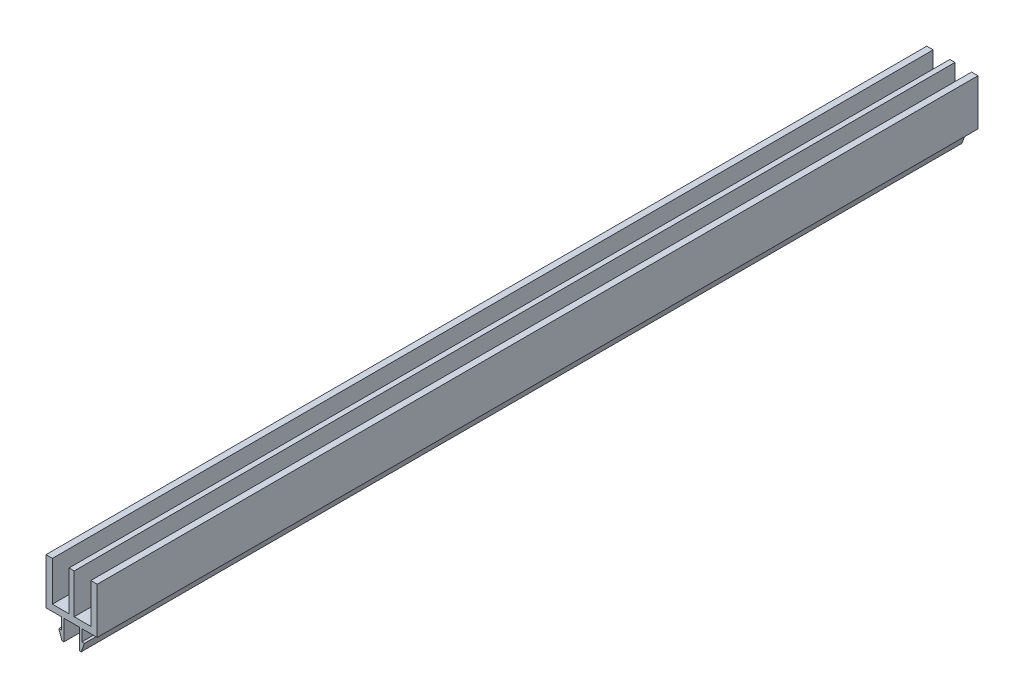
from build123d import *

# Parameters (mm, degrees)
BOSS_EXTRU_1_DEPTH = 344


with BuildPart() as part:
    # Esquisse1 → Boss.-Extru.1 (new body)
    with BuildSketch(Plane.XY.offset(50)):
        Polygon((-1, 2.5), (-7.5, 2.5), (-7.5, 17.999999998), (-10, 17.999999998), (-10, 0), (-4, 0), (-4, -4.5), (-5, -4.5), (-3.75, -8), (-3, -8), (-3, 0), (3, 0), (3, -8), (3.75, -8), (5, -4.5), (4, -4.5), (4, 0), (10, 0), (10, 17.999999998), (7.5, 17.999999998), (7.5, 2.5), (1, 2.5), (1, 17.999999998), (-1, 17.999999998), align=None)
    extrude(amount=-BOSS_EXTRU_1_DEPTH)


solid = part.part
